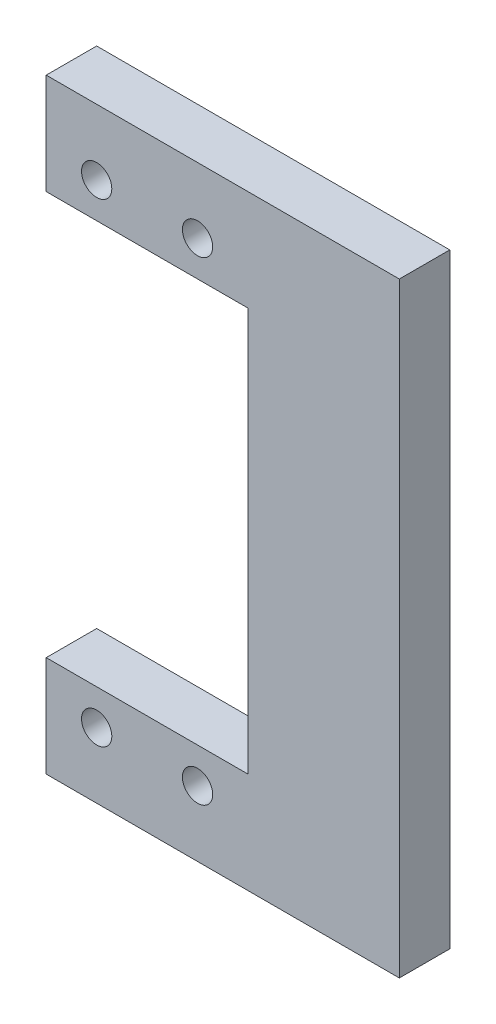
from build123d import *

# Parameters (mm, degrees)
ESQUISSE1_R        = 1.5
BOSS_EXTRU_1_DEPTH = 5


with BuildPart() as part:
    # Esquisse1 → Boss.-Extru.1 (new body)
    with BuildSketch(Plane.XY):
        Polygon((0, 0), (35, 0), (35, 60), (0, 60), (0, 50), (20, 50), (20, 10), (0, 10), align=None)
        with Locations((5, 53.5)):
            Circle(ESQUISSE1_R, mode=Mode.SUBTRACT)
        with Locations(Location((15, 53.5, 0), (0, 0, 180))):
            Circle(ESQUISSE1_R, mode=Mode.SUBTRACT)
        with Locations((15, 6.5)):
            Circle(ESQUISSE1_R, mode=Mode.SUBTRACT)
        with Locations(Location((5, 6.5, 0), (0, 0, 180))):
            Circle(ESQUISSE1_R, mode=Mode.SUBTRACT)
    extrude(amount=BOSS_EXTRU_1_DEPTH)


solid = part.part
